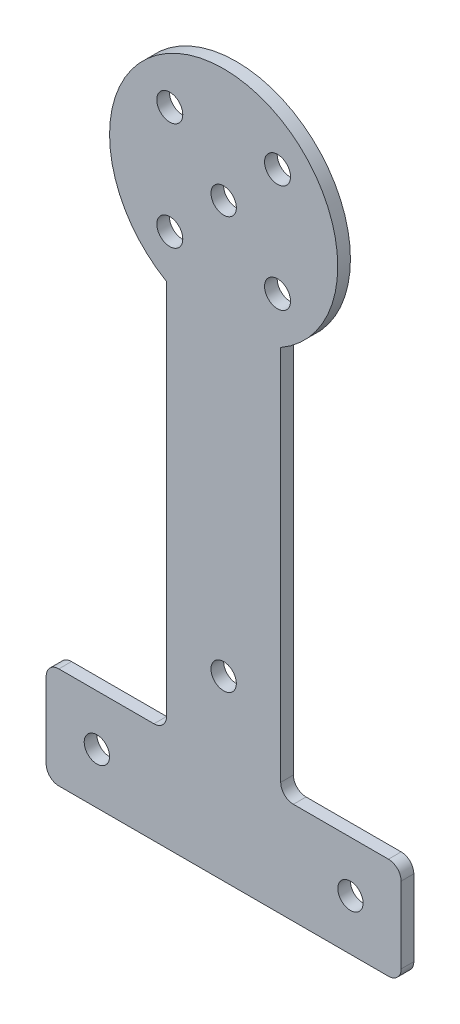
from build123d import *

# Parameters (mm, degrees)
SKETCH_1_R      = 2
SKETCH_1_R_2    = 2.05
EXTRUDE_1_DEPTH = 2
FILLET_1_R      = 2


with BuildPart() as part:
    # 草图1 → 凸台-拉伸1 (new body)
    with BuildSketch(Plane.XY):
        with BuildLine():
            Line((14.659550972, 19.565520938), (14.659550972, 35.565520938))
            Line((14.659550972, 35.565520938), (-4.340449028, 35.565520938))
            Line((-4.340449028, 35.565520938), (-4.340449028, 96.97706367))
            ThreePointArc((-4.340449028, 96.97706367), (-13.340449028, 130.565520938), (-22.340449028, 96.97706367))
            Line((-22.340449028, 96.97706367), (-22.340449028, 35.565520938))
            Line((-22.340449028, 35.565520938), (-41.340449028, 35.565520938))
            Line((-41.340449028, 35.565520938), (-41.340449028, 19.565520938))
            Line((-41.340449028, 19.565520938), (14.659550972, 19.565520938))
        make_face()
        with Locations((-33.340449028, 27.565520938)):
            Circle(SKETCH_1_R, mode=Mode.SUBTRACT)
        with Locations(Location((6.659550972, 27.565520938, 0), (0, 0, 180))):
            Circle(SKETCH_1_R, mode=Mode.SUBTRACT)
        with Locations((-13.340449028, 112.565520938)):
            Circle(SKETCH_1_R, mode=Mode.SUBTRACT)
        with Locations((-13.340449028, 47.565520938)):
            Circle(SKETCH_1_R, mode=Mode.SUBTRACT)
        with Locations((-4.840449028, 121.065520938)):
            Circle(SKETCH_1_R_2, mode=Mode.SUBTRACT)
        with Locations((-4.840449028, 104.065520938)):
            Circle(SKETCH_1_R_2, mode=Mode.SUBTRACT)
        with Locations((-21.840449028, 104.065520938)):
            Circle(SKETCH_1_R_2, mode=Mode.SUBTRACT)
        with Locations((-21.840449028, 121.065520938)):
            Circle(SKETCH_1_R_2, mode=Mode.SUBTRACT)
    extrude(amount=EXTRUDE_1_DEPTH)

    # 圆角1
    fillet_1_edges = [part.edges().sort_by_distance(p)[0] for p in [
        (-41.340449028, 19.565520938, 1),
        (-41.340449028, 35.565520938, 1),
        (-22.340449028, 35.565520938, 1),
        (-4.340449028, 35.565520938, 1),
        (14.659550972, 35.565520938, 1),
        (14.659550972, 19.565520938, 1),
    ]]
    fillet(fillet_1_edges, radius=FILLET_1_R)


solid = part.part
